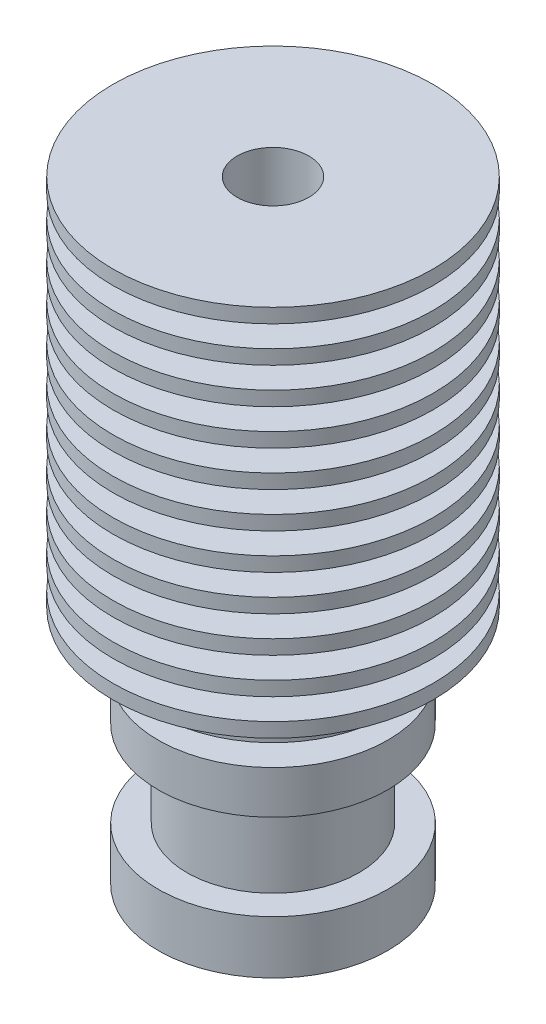
from build123d import *


with BuildPart() as part:
    # Эскиз1 → Повернуть1 (revolve)
    with BuildSketch(Plane.XY):
        Polygon((5.024077793, 22.7), (5.102689462, 24.2), (11.15, 24.2), (11.15, 25.2), (5.155097241, 25.2), (5.23370891, 26.7), (11.15, 26.7), (11.15, 27.7), (5.286116689, 27.7), (5.364728358, 29.2), (11.15, 29.2), (11.15, 30.2), (5.417136137, 30.2), (5.495747806, 31.7), (11.15, 31.7), (11.15, 32.7), (5.548155586, 32.7), (5.626767255, 34.2), (11.15, 34.2), (11.15, 35.2), (5.679175034, 35.2), (5.757786703, 36.7), (11.15, 36.7), (11.15, 37.7), (5.810194482, 37.7), (5.888806151, 39.2), (11.15, 39.2), (11.15, 40.2), (5.94121393, 40.2), (6.019825599, 41.7), (11.15, 41.7), (11.15, 42.7), (2.5, 42.7), (2.5, 24.8), (2.1, 24.559655752), (2.1, 12.7), (3.25, 12.7), (3.25, 9.7), (2.1, 9.7), (2.1, 0), (8, 0), (8, 3.7), (6, 3.7), (6, 9.7), (8, 9.7), (8, 12.7), (4.5, 12.7), (4.578611669, 14.2), (8, 14.2), (8, 15.2), (4.631019448, 15.2), (4.709631117, 16.7), (11.15, 16.7), (11.15, 17.7), (4.762038896, 17.7), (4.840650565, 19.2), (11.15, 19.2), (11.15, 20.2), (4.893058345, 20.2), (4.971670014, 21.7), (11.15, 21.7), (11.15, 22.7), align=None)
    revolve(axis=Axis((0, 42.7, 0), (0, -1, 0)))


solid = part.part
